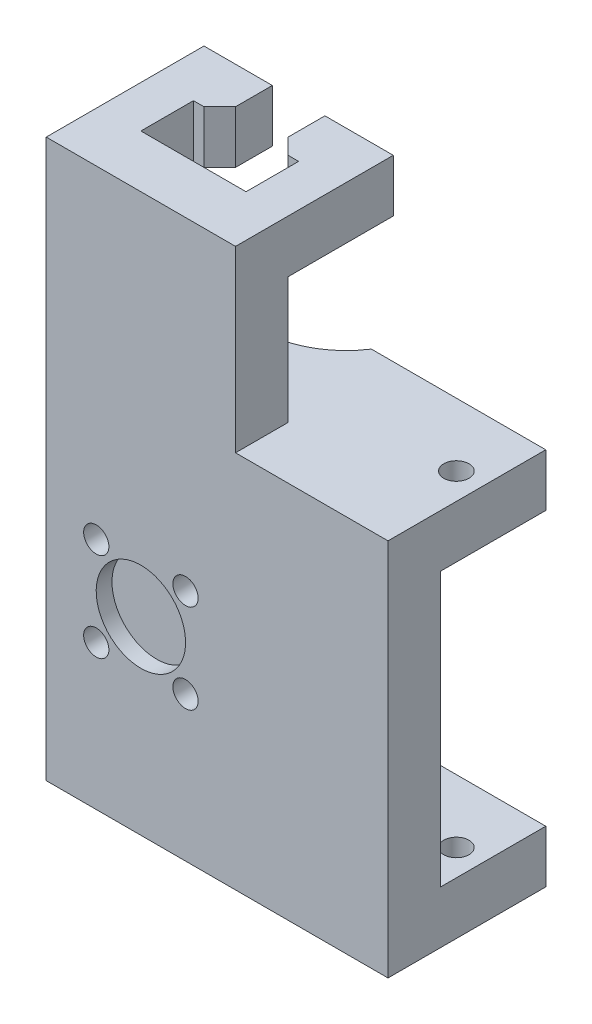
from build123d import *

# Parameters (mm, degrees)
SKETCH_1_W                   = 32.5
SKETCH_1_H                   = 36
EXTRUDE_1_DEPTH              = 15
SKETCH_2_W                   = 10
SKETCH_2_H                   = 26
CUT_EXTRUDE_1_DEPTH          = 41.065571255
HOLE_WIZARD_M2_1_D           = 2.4
HOLE_WIZARD_M2_1_DEPTH       = 5
CUT_EXTRUDE_3_DEPTH          = 39.079686186
CUT_EXTRUDE_3_DEPTH_BACK     = 39.079686186
SKETCH_4_R                   = 8.25
SKETCH_4_R_2                 = 1.2
HOLE_WIZARD_M2_2_D           = 2.4
HOLE_WIZARD_M2_2_CBORE_D     = 3.85
HOLE_WIZARD_M2_2_CBORE_DEPTH = 1.45
SKETCH_13_W                  = 18
SKETCH_13_H                  = 15
EXTRUDE_3_DEPTH              = 17
CUT_EXTRUDE_4_DEPTH          = 42.401237904
CUT_EXTRUDE_4_DEPTH_BACK     = 10
SKETCH_14_W                  = 18
SKETCH_14_H                  = 12
CUT_EXTRUDE_5_REACH          = 59.429
SKETCH_15_W                  = 5
SKETCH_15_H                  = 10
CUT_EXTRUDE_START            = -5
SKETCH_16_W                  = 10
SKETCH_16_H                  = 5
CUT_EXTRUDE_6_DEPTH          = 5
CHAMFER_1_SIZE               = 1.5
CUT_EXTRUDE_7_DEPTH          = 1.5


with BuildPart() as part:
    # ｽｹｯﾁ1 → ﾎﾞｽ - 押し出し1 (new body)
    with BuildSketch(Plane.XY):
        Rectangle(SKETCH_1_W, SKETCH_1_H)
    extrude(amount=EXTRUDE_1_DEPTH)

    # ｽｹｯﾁ2 → ｶｯﾄ - 押し出し1 (cut, through all)
    with BuildSketch(Plane(origin=(16.25, 0, 0), x_dir=(0, 0, -1), z_dir=(1, 0, 0))):
        with Locations((-5, 0)):
            Rectangle(SKETCH_2_W, SKETCH_2_H)
    extrude(amount=-CUT_EXTRUDE_1_DEPTH, mode=Mode.SUBTRACT)

    # M2 すきま穴1
    with Locations(Plane.XZ.offset(-13)):
        with Locations((13.75, 6), (-7.25, 6)):
            hole_wizard_m2_1 = Hole(HOLE_WIZARD_M2_1_D / 2, depth=HOLE_WIZARD_M2_1_DEPTH)

    # ｽｹｯﾁ4 → ｶｯﾄ - 押し出し3 (cut, two sides: drawn at the far end of the back side and taken through both)
    with BuildSketch(Plane.XZ.offset(-13).offset(-CUT_EXTRUDE_3_DEPTH_BACK)):
        with Locations((-7.25, -4.5)):
            Circle(SKETCH_4_R)
        with Locations(Location((-7.25, 6, 0), (0, 0, 270))):
            Circle(SKETCH_4_R_2)
    extrude(amount=CUT_EXTRUDE_3_DEPTH + CUT_EXTRUDE_3_DEPTH_BACK, mode=Mode.SUBTRACT)

    # ﾐﾗｰ1: M2 すきま穴1 across plane
    add(hole_wizard_m2_1.mirror(Plane.ZX), mode=Mode.SUBTRACT)

    # M2 丸平ねじ用座ぐり穴2 (through all)
    with Locations(Plane(origin=(0, 0, 10), x_dir=(-1, 0, 0), z_dir=(0, 0, -1))):
        with Locations((11.492640687, 4.242640687), (3.007359313, -4.242640687), (11.492640687, -4.242640687), (3.007359313, 4.242640687)):
            CounterBoreHole(HOLE_WIZARD_M2_2_D / 2, HOLE_WIZARD_M2_2_CBORE_D / 2, HOLE_WIZARD_M2_2_CBORE_DEPTH)

    # ｽｹｯﾁ13 → ﾎﾞｽ - 押し出し3 (add)
    with BuildSketch(Plane(origin=(0, 18, 0), x_dir=(1, 0, 0), z_dir=(0, 1, 0))):
        with Locations((-7.25, -7.5)):
            Rectangle(SKETCH_13_W, SKETCH_13_H)
    extrude(amount=EXTRUDE_3_DEPTH)

    # ｽｹｯﾁ14 → ｶｯﾄ - 押し出し4 (cut, two sides: drawn at the far end of the back side and taken through both)
    with BuildSketch(Plane(origin=(0, 0, 0), x_dir=(-1, 0, 0), z_dir=(0, 0, -1)).offset(-CUT_EXTRUDE_4_DEPTH_BACK)):
        with Locations((7.25, 24)):
            Rectangle(SKETCH_14_W, SKETCH_14_H)
    extrude(amount=CUT_EXTRUDE_4_DEPTH + CUT_EXTRUDE_4_DEPTH_BACK, mode=Mode.SUBTRACT)

    # ｽｹｯﾁ15 → ｶｯﾄ - 押し出し5 (cut, up to next)
    with BuildSketch(Plane(origin=(0, 35, 0), x_dir=(1, 0, 0), z_dir=(0, 1, 0)), mode=Mode.PRIVATE) as cut_extrude_5_sk1:
        with Locations((-7.25, -5)):
            Rectangle(SKETCH_15_W, SKETCH_15_H)
    cut_extrude_5_tool1 = extrude(cut_extrude_5_sk1.sketch, amount=-CUT_EXTRUDE_5_REACH, mode=Mode.PRIVATE) & part.part
    add(cut_extrude_5_tool1.solids().sort_by_distance((-7.25, 35, 5))[0], mode=Mode.SUBTRACT)

    # ｽｹｯﾁ16 → ｶｯﾄ - 押し出し6 (cut)
    with BuildSketch(Plane(origin=(0, 35, 0), x_dir=(1, 0, 0), z_dir=(0, 1, 0)).offset(CUT_EXTRUDE_START)):
        with Locations((-7.25, -7.5)):
            Rectangle(SKETCH_16_W, SKETCH_16_H)
    extrude(amount=CUT_EXTRUDE_6_DEPTH, mode=Mode.SUBTRACT)

    # 面取り1
    chamfer_1_edges = [part.edges().sort_by_distance(p)[0] for p in [
        (-9.75, 32.5, 5),
        (-4.75, 32.5, 5),
    ]]
    chamfer(chamfer_1_edges, length=CHAMFER_1_SIZE)

    # ｽｹｯﾁ17 → ｶｯﾄ - 押し出し7 (cut)
    with BuildSketch(Plane.XY.offset(15)):
        with BuildLine():
            Line((-7, 4.242640687), (-7.5, 4.242640687))
            ThreePointArc((-7.5, 4.242640687), (-10.25520382, -3.00520382), (-3.007359313, -0.25))
            Line((-3.007359313, -0.25), (-3.007359313, 0.25))
            ThreePointArc((-3.007359313, 0.25), (-4.24479618, 3.00520382), (-7, 4.242640687))
        make_face()
    extrude(amount=-CUT_EXTRUDE_7_DEPTH, mode=Mode.SUBTRACT)


solid = part.part
